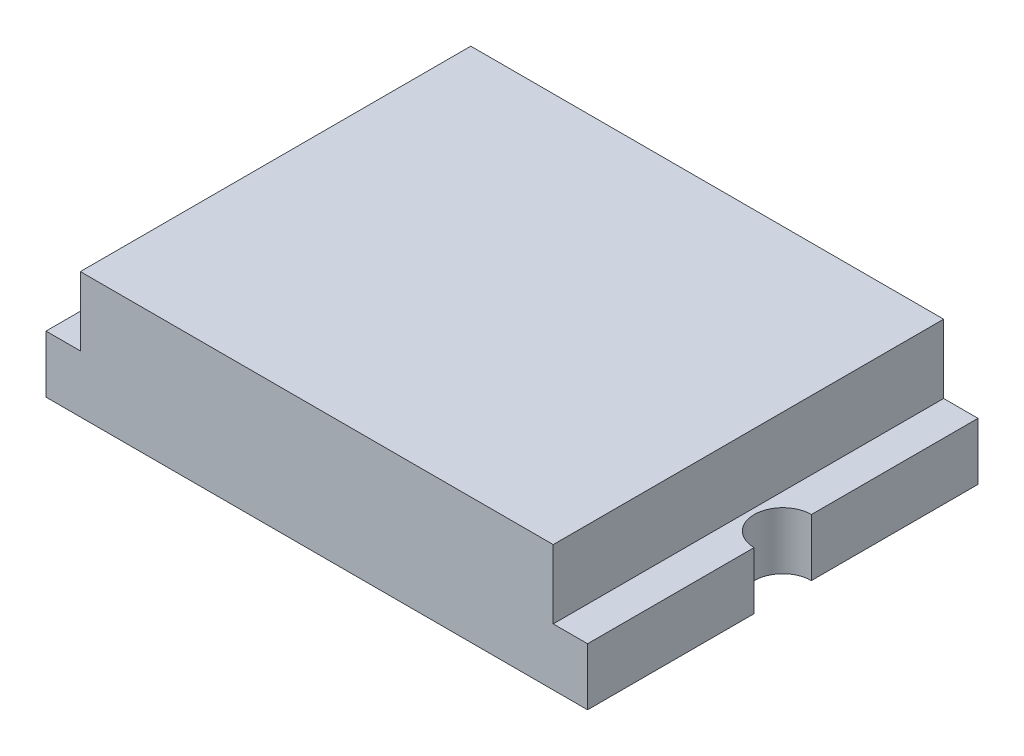
from build123d import *

# Parameters (mm, degrees)
EXTRUDE_1_DEPTH   = 0.5
EXTRUDE_1_2_DEPTH = 0.5
SKETCH_2_W        = 4.13
SKETCH_2_H        = 3.41
EXTRUDE_2_DEPTH   = 1.1


with BuildPart() as part:
    # 草图1 → 凸台-拉伸1 (new body)
    with BuildSketch(Plane(origin=(0, 0, 0), x_dir=(1, 0, 0), z_dir=(0, 1, 0))):
        with BuildLine():
            Line((-2.365, -1.705), (-2.065, -1.705))
            Line((-2.065, -1.705), (-2.065, 1.705))
            Line((-2.065, 1.705), (-2.365, 1.705))
            Line((-2.365, 1.705), (-2.365, 0.25))
            ThreePointArc((-2.365, 0.25), (-2.115, 0), (-2.365, -0.25))
            Line((-2.365, -0.25), (-2.365, -1.705))
        make_face()
    extrude(amount=EXTRUDE_1_DEPTH)



with BuildPart() as body_2:
    # 草图1 → Extrude 1 2 (new body)
    with BuildSketch(Plane(origin=(0, 0, 0), x_dir=(1, 0, 0), z_dir=(0, 1, 0))):
        with BuildLine():
            Line((2.365, -1.705), (2.365, -0.25))
            ThreePointArc((2.365, -0.25), (2.115, 0), (2.365, 0.25))
            Line((2.365, 0.25), (2.365, 1.705))
            Line((2.365, 1.705), (2.065, 1.705))
            Line((2.065, 1.705), (2.065, -1.705))
            Line((2.065, -1.705), (2.365, -1.705))
        make_face()
    extrude(amount=EXTRUDE_1_2_DEPTH)


with BuildPart() as part_1:
    add(part.part)

    add(body_2.part)  # 凸台-拉伸2 merges body 2
    # 草图2 → 凸台-拉伸2 (add)
    with BuildSketch(Plane(origin=(0, 0, 0), x_dir=(1, 0, 0), z_dir=(0, 1, 0))):
        Rectangle(SKETCH_2_W, SKETCH_2_H)
    extrude(amount=EXTRUDE_2_DEPTH)


solid = part_1.part
